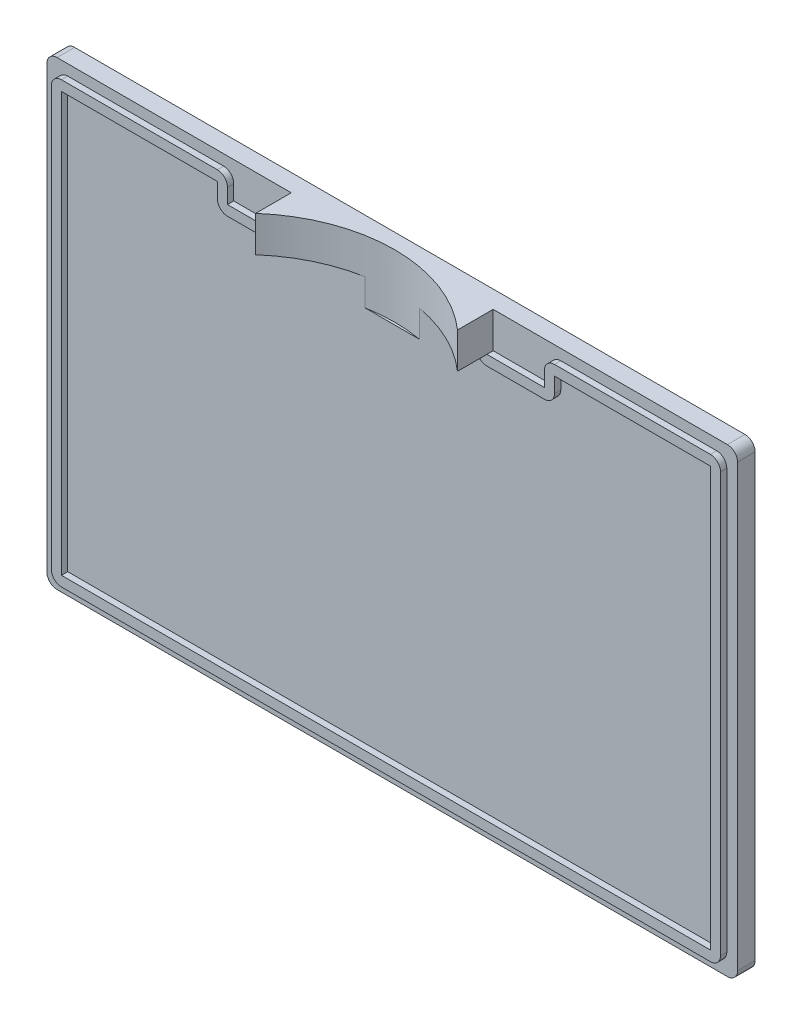
from build123d import *

# Parameters (mm, degrees)
BOSS_EXTRUDE1_DEPTH = 2.8
BOSS_EXTRUDE2_DEPTH = 1
SKETCH3_W           = 32.16332029
SKETCH3_H           = 5.710000001
BOSS_EXTRUDE3_DEPTH = 5.8
CUT_EXTRUDE1_DEPTH  = 10


with BuildPart() as part:
    # Sketch1 → Boss-Extrude1 (new body)
    with BuildSketch(Plane.XY):
        with BuildLine():
            Line((-53.39, 36.695), (53.39, 36.695))
            ThreePointArc((53.39, 36.695), (54.528441918, 36.223441918), (55, 35.085))
            Line((55, 35.085), (55, -35.085))
            ThreePointArc((55, -35.085), (54.528441918, -36.223441918), (53.39, -36.695))
            Line((53.39, -36.695), (-53.39, -36.695))
            ThreePointArc((-53.39, -36.695), (-54.528441918, -36.223441918), (-55, -35.085))
            Line((-55, -35.085), (-55, 35.085))
            ThreePointArc((-55, 35.085), (-54.528441918, 36.223441918), (-53.39, 36.695))
        make_face()
    extrude(amount=BOSS_EXTRUDE1_DEPTH)

    # Sketch2 → Boss-Extrude2 (add)
    with BuildSketch(Plane.XY.offset(2.8)):
        with BuildLine():
            Line((25.241660148, 33.374999999), (25.241660148, 30.984999999))
            Line((25.241660148, 30.984999999), (14.471660145, 30.984999999))
            ThreePointArc((14.471660145, 30.984999999), (14.943218227, 29.846558082), (16.081660145, 29.374999999))
            Line((16.081660145, 29.374999999), (25.241660148, 29.374999999))
            ThreePointArc((25.241660148, 29.374999999), (26.380102065, 29.846558082), (26.851660148, 30.984999999))
            Line((26.851660148, 30.984999999), (26.851660148, 33.374999999))
            Line((26.851660148, 33.374999999), (51.679999999, 33.374999999))
            Line((51.679999999, 33.374999999), (51.679999999, -33.374999999))
            Line((51.679999999, -33.374999999), (-51.679999999, -33.374999999))
            Line((-51.679999999, -33.374999999), (-51.679999999, 33.374999999))
            Line((-51.679999999, 33.374999999), (-26.851660148, 33.374999999))
            Line((-26.851660148, 33.374999999), (-26.851660148, 30.984999999))
            ThreePointArc((-26.851660148, 30.984999999), (-26.380102065, 29.846558082), (-25.241660148, 29.374999999))
            Line((-25.241660148, 29.374999999), (-16.081660145, 29.374999999))
            ThreePointArc((-16.081660145, 29.374999999), (-14.943218227, 29.846558082), (-14.471660145, 30.984999999))
            Line((-14.471660145, 30.984999999), (-25.241660148, 30.984999999))
            Line((-25.241660148, 30.984999999), (-25.241660148, 33.374999999))
            ThreePointArc((-25.241660148, 33.374999999), (-25.71321823, 34.513441917), (-26.851660148, 34.984999999))
            Line((-26.851660148, 34.984999999), (-51.679999999, 34.984999999))
            ThreePointArc((-51.679999999, 34.984999999), (-52.818441916, 34.513441917), (-53.289999999, 33.374999999))
            Line((-53.289999999, 33.374999999), (-53.289999999, -33.374999999))
            ThreePointArc((-53.289999999, -33.374999999), (-52.818441916, -34.513441917), (-51.679999999, -34.984999999))
            Line((-51.679999999, -34.984999999), (51.679999999, -34.984999999))
            ThreePointArc((51.679999999, -34.984999999), (52.818441916, -34.513441917), (53.289999999, -33.374999999))
            Line((53.289999999, -33.374999999), (53.289999999, 33.374999999))
            ThreePointArc((53.289999999, 33.374999999), (52.818441916, 34.513441917), (51.679999999, 34.984999999))
            Line((51.679999999, 34.984999999), (26.851660148, 34.984999999))
            ThreePointArc((26.851660148, 34.984999999), (25.71321823, 34.513441917), (25.241660148, 33.374999999))
        make_face()
    extrude(amount=BOSS_EXTRUDE2_DEPTH)

    # Sketch3 → Boss-Extrude3 (add)
    with BuildSketch(Plane.XY.offset(2.8)):
        with Locations((0, 33.84)):
            Rectangle(SKETCH3_W, SKETCH3_H)
    extrude(amount=BOSS_EXTRUDE3_DEPTH)

    # Sketch4 → Cut-Extrude1 (cut)
    with BuildSketch(Plane(origin=(0, 36.695, 0), x_dir=(1, 0, 0), z_dir=(0, 1, 0))):
        with BuildLine():
            Line((-16.081660145, -8.479373109), (-16.081660145, -8.6))
            Line((-16.081660145, -8.6), (16.081660145, -8.6))
            Line((16.081660145, -8.6), (16.081660145, -8.479373109))
            ThreePointArc((16.081660145, -8.479373109), (0, -2.41), (-16.081660145, -8.479373109))
        make_face()
    extrude(amount=-CUT_EXTRUDE1_DEPTH, mode=Mode.SUBTRACT)


solid = part.part
